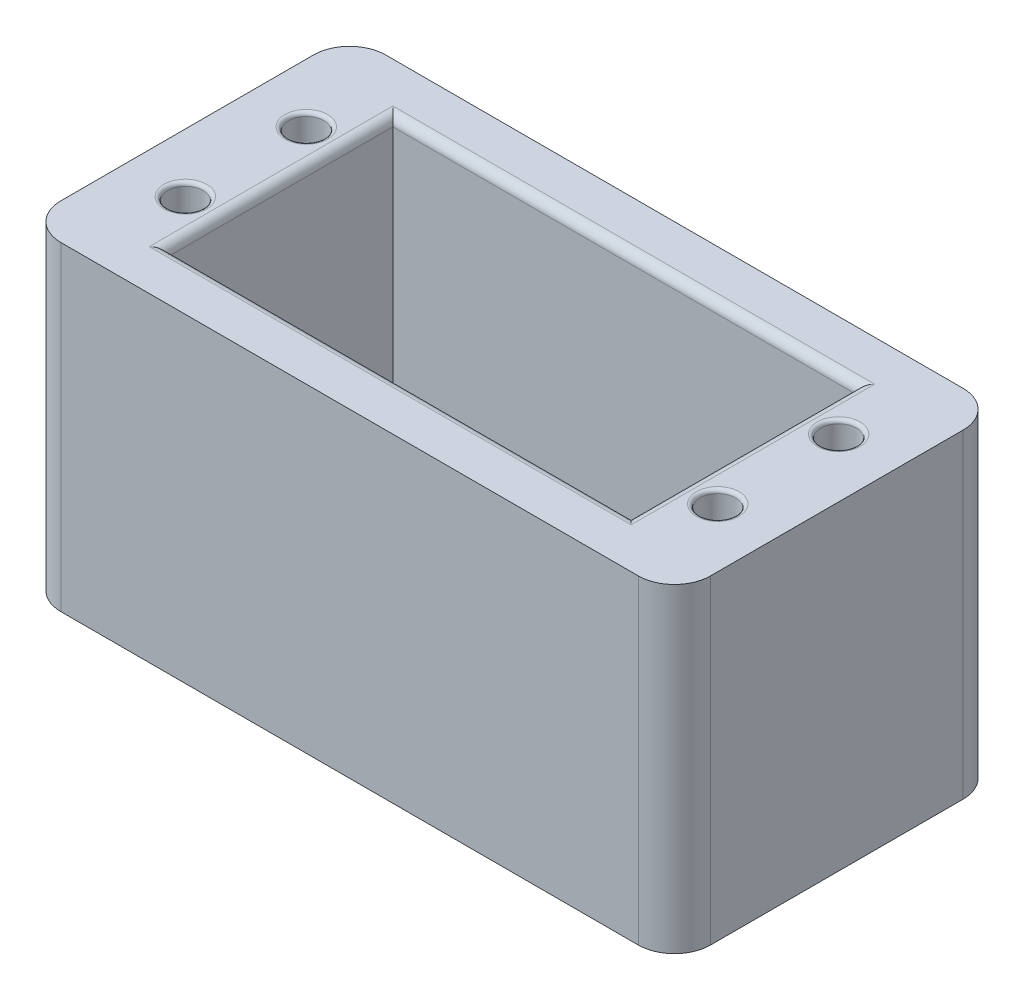
from build123d import *

# Parameters (mm, degrees)
SKETCH1_W           = 91.44
SKETCH1_H           = 45.72
BOSS_EXTRUDE1_DEPTH = 45
SKETCH2_W           = 65.278
SKETCH2_H           = 31.75
CUT_EXTRUDE1_DEPTH  = 40
SKETCH3_R           = 2.5
CUT_EXTRUDE2_DEPTH  = 25.4
FILLET1_R           = 5.08
FILLET3_R           = 1.27
FILLET4_R           = 0.508


with BuildPart() as part:
    # Sketch1 → Boss-Extrude1 (new body)
    with BuildSketch(Plane(origin=(0, 0, 0), x_dir=(1, 0, 0), z_dir=(0, 1, 0))):
        Rectangle(SKETCH1_W, SKETCH1_H)
    extrude(amount=BOSS_EXTRUDE1_DEPTH)

    # Sketch2 → Cut-Extrude1 (cut)
    with BuildSketch(Plane(origin=(0, 45, 0), x_dir=(1, 0, 0), z_dir=(0, 1, 0))):
        Rectangle(SKETCH2_W, SKETCH2_H)
    extrude(amount=-CUT_EXTRUDE1_DEPTH, mode=Mode.SUBTRACT)

    # Sketch3 → Cut-Extrude2 (cut)
    with BuildSketch(Plane(origin=(0, 45, 0), x_dir=(1, 0, 0), z_dir=(0, 1, 0))):
        with Locations(Location((37.465, 8.509, 0), (0, 0, 270))):
            Circle(SKETCH3_R)
        with Locations(Location((37.465, -8.509, 0), (0, 0, 270))):
            Circle(SKETCH3_R)
        with Locations(Location((-37.465, -8.509, 0), (0, 0, 90))):
            Circle(SKETCH3_R)
        with Locations(Location((-37.465, 8.509, 0), (0, 0, 90))):
            Circle(SKETCH3_R)
    extrude(amount=-CUT_EXTRUDE2_DEPTH, mode=Mode.SUBTRACT)

    # Fillet1
    fillet1_edges = [part.edges().sort_by_distance(p)[0] for p in [
        (45.72, 22.5, 22.86),
        (-45.72, 22.5, 22.86),
        (-45.72, 22.5, -22.86),
        (45.72, 22.5, -22.86),
    ]]
    fillet(fillet1_edges, radius=FILLET1_R)

    # Fillet3
    fillet3_edges = [part.edges().sort_by_distance(p)[0] for p in [
        (32.639, 45, 0),
        (0, 45, -15.875),
        (-32.639, 45, 0),
        (0, 45, 15.875),
    ]]
    fillet(fillet3_edges, radius=FILLET3_R)

    # Fillet4
    fillet4_edges = [part.edges().sort_by_distance(p)[0] for p in [
        (-37.465, 45, -6.009),
        (-37.465, 45, 11.009),
        (37.465, 45, 6.009),
        (37.465, 45, -11.009),
    ]]
    fillet(fillet4_edges, radius=FILLET4_R)


solid = part.part
